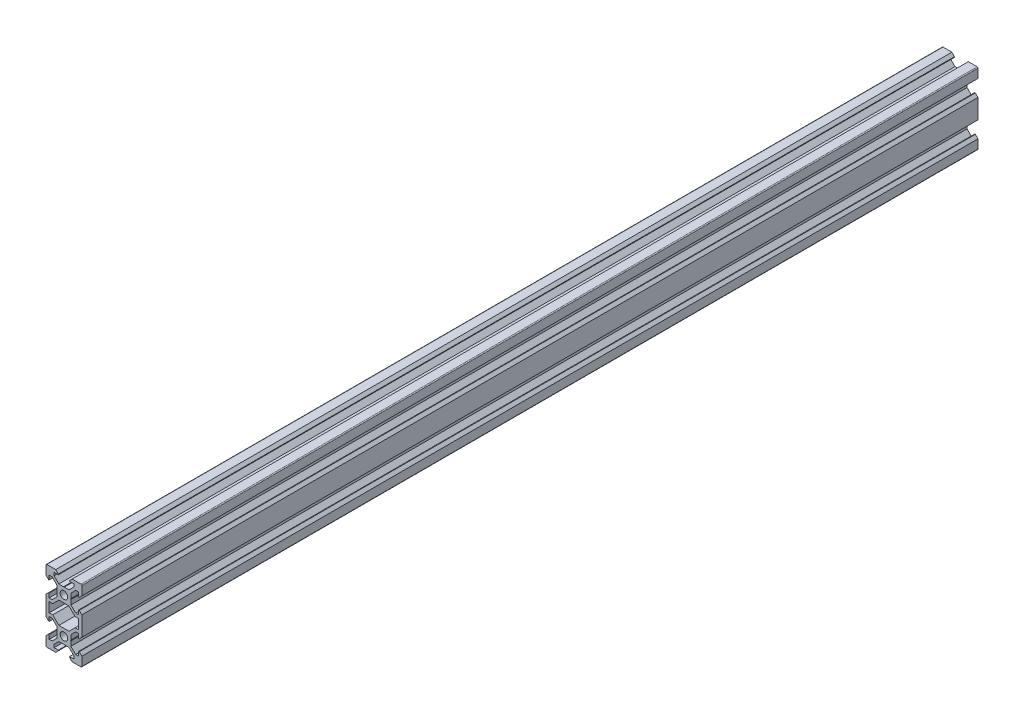
from build123d import *

# Parameters (mm, degrees)
SKETCH2_R           = 2.1
BOSS_EXTRUDE1_DEPTH = 500


with BuildPart() as part:
    # Sketch2 → Boss-Extrude1 (new body)
    with BuildSketch(Plane.XY):
        with BuildLine():
            Line((4.006804208, 10.145798499), (3.796804208, 10.355798499))
            Line((3.796804208, 10.355798499), (4.006804208, 10.565798499))
            Line((4.006804208, 10.565798499), (4.006804208, 13.195138327))
            Line((4.006804208, 13.195138327), (6.66746438, 15.855798499))
            Line((6.66746438, 15.855798499), (8.306804208, 15.855798499))
            Line((8.306804208, 15.855798499), (8.306804208, 13.480798499))
            Line((8.306804208, 13.480798499), (8.651804208, 13.480798499))
            Line((8.651804208, 13.480798499), (10.106804208, 14.935798499))
            Line((10.106804208, 14.935798499), (10.106804208, 19.855798499))
            ThreePointArc((10.106804208, 19.855798499), (9.960357598, 20.209351889), (9.606804208, 20.355798499))
            Line((9.606804208, 20.355798499), (4.686804208, 20.355798499))
            Line((4.686804208, 20.355798499), (3.231804208, 18.900798499))
            Line((3.231804208, 18.900798499), (3.231804208, 18.555798499))
            Line((3.231804208, 18.555798499), (5.606804208, 18.555798499))
            Line((5.606804208, 18.555798499), (5.606804208, 16.91645867))
            Line((5.606804208, 16.91645867), (2.946144036, 14.255798499))
            Line((2.946144036, 14.255798499), (0.316804208, 14.255798499))
            Line((0.316804208, 14.255798499), (0.106804208, 14.045798499))
            Line((0.106804208, 14.045798499), (-0.103195792, 14.255798499))
            Line((-0.103195792, 14.255798499), (-2.73253562, 14.255798499))
            Line((-2.73253562, 14.255798499), (-5.393195792, 16.91645867))
            Line((-5.393195792, 16.91645867), (-5.393195792, 18.555798499))
            Line((-5.393195792, 18.555798499), (-3.018195792, 18.555798499))
            Line((-3.018195792, 18.555798499), (-3.018195792, 18.900798499))
            Line((-3.018195792, 18.900798499), (-4.473195792, 20.355798499))
            Line((-4.473195792, 20.355798499), (-9.393195792, 20.355798499))
            ThreePointArc((-9.393195792, 20.355798499), (-9.746749183, 20.209351889), (-9.893195792, 19.855798499))
            Line((-9.893195792, 19.855798499), (-9.893195792, 14.935798499))
            Line((-9.893195792, 14.935798499), (-8.438195792, 13.480798499))
            Line((-8.438195792, 13.480798499), (-8.093195792, 13.480798499))
            Line((-8.093195792, 13.480798499), (-8.093195792, 15.855798499))
            Line((-8.093195792, 15.855798499), (-6.453855964, 15.855798499))
            Line((-6.453855964, 15.855798499), (-3.793195792, 13.195138327))
            Line((-3.793195792, 13.195138327), (-3.793195792, 10.565798499))
            Line((-3.793195792, 10.565798499), (-3.583195792, 10.355798499))
            Line((-3.583195792, 10.355798499), (-3.793195792, 10.145798499))
            Line((-3.793195792, 10.145798499), (-3.793195792, 7.51645867))
            Line((-3.793195792, 7.51645867), (-6.453855964, 4.855798499))
            Line((-6.453855964, 4.855798499), (-8.093195792, 4.855798499))
            Line((-8.093195792, 4.855798499), (-8.093195792, 7.230798499))
            Line((-8.093195792, 7.230798499), (-8.438195792, 7.230798499))
            Line((-8.438195792, 7.230798499), (-9.893195792, 5.775798499))
            Line((-9.893195792, 5.775798499), (-9.893195792, -5.064201501))
            Line((-9.893195792, -5.064201501), (-8.438195792, -6.519201501))
            Line((-8.438195792, -6.519201501), (-8.093195792, -6.519201501))
            Line((-8.093195792, -6.519201501), (-8.093195792, -4.144201501))
            Line((-8.093195792, -4.144201501), (-6.453855964, -4.144201501))
            Line((-6.453855964, -4.144201501), (-3.793195792, -6.804861673))
            Line((-3.793195792, -6.804861673), (-3.793195792, -9.434201501))
            Line((-3.793195792, -9.434201501), (-3.583195792, -9.644201501))
            Line((-3.583195792, -9.644201501), (-3.793195792, -9.854201501))
            Line((-3.793195792, -9.854201501), (-3.793195792, -12.48354133))
            Line((-3.793195792, -12.48354133), (-6.453855964, -15.144201501))
            Line((-6.453855964, -15.144201501), (-8.093195792, -15.144201501))
            Line((-8.093195792, -15.144201501), (-8.093195792, -12.769201501))
            Line((-8.093195792, -12.769201501), (-8.438195792, -12.769201501))
            Line((-8.438195792, -12.769201501), (-9.893195792, -14.224201501))
            Line((-9.893195792, -14.224201501), (-9.893195792, -19.144201501))
            ThreePointArc((-9.893195792, -19.144201501), (-9.746749183, -19.497754892), (-9.393195792, -19.644201501))
            Line((-9.393195792, -19.644201501), (-4.473195792, -19.644201501))
            Line((-4.473195792, -19.644201501), (-3.018195792, -18.189201501))
            Line((-3.018195792, -18.189201501), (-3.018195792, -17.844201501))
            Line((-3.018195792, -17.844201501), (-5.393195792, -17.844201501))
            Line((-5.393195792, -17.844201501), (-5.393195792, -16.204861673))
            Line((-5.393195792, -16.204861673), (-2.73253562, -13.544201501))
            Line((-2.73253562, -13.544201501), (-0.103195792, -13.544201501))
            Line((-0.103195792, -13.544201501), (0.106804208, -13.334201501))
            Line((0.106804208, -13.334201501), (0.316804208, -13.544201501))
            Line((0.316804208, -13.544201501), (2.946144036, -13.544201501))
            Line((2.946144036, -13.544201501), (5.606804208, -16.204861673))
            Line((5.606804208, -16.204861673), (5.606804208, -17.844201501))
            Line((5.606804208, -17.844201501), (3.231804208, -17.844201501))
            Line((3.231804208, -17.844201501), (3.231804208, -18.189201501))
            Line((3.231804208, -18.189201501), (4.686804208, -19.644201501))
            Line((4.686804208, -19.644201501), (9.606804208, -19.644201501))
            ThreePointArc((9.606804208, -19.644201501), (9.960357598, -19.497754892), (10.106804208, -19.144201501))
            Line((10.106804208, -19.144201501), (10.106804208, -14.224201501))
            Line((10.106804208, -14.224201501), (8.651804208, -12.769201501))
            Line((8.651804208, -12.769201501), (8.306804208, -12.769201501))
            Line((8.306804208, -12.769201501), (8.306804208, -15.144201501))
            Line((8.306804208, -15.144201501), (6.66746438, -15.144201501))
            Line((6.66746438, -15.144201501), (4.006804208, -12.48354133))
            Line((4.006804208, -12.48354133), (4.006804208, -9.854201501))
            Line((4.006804208, -9.854201501), (3.796804208, -9.644201501))
            Line((3.796804208, -9.644201501), (4.006804208, -9.434201501))
            Line((4.006804208, -9.434201501), (4.006804208, -6.804861673))
            Line((4.006804208, -6.804861673), (6.66746438, -4.144201501))
            Line((6.66746438, -4.144201501), (8.306804208, -4.144201501))
            Line((8.306804208, -4.144201501), (8.306804208, -6.519201501))
            Line((8.306804208, -6.519201501), (8.651804208, -6.519201501))
            Line((8.651804208, -6.519201501), (10.106804208, -5.064201501))
            Line((10.106804208, -5.064201501), (10.106804208, 5.775798499))
            Line((10.106804208, 5.775798499), (8.651804208, 7.230798499))
            Line((8.651804208, 7.230798499), (8.306804208, 7.230798499))
            Line((8.306804208, 7.230798499), (8.306804208, 4.855798499))
            Line((8.306804208, 4.855798499), (6.66746438, 4.855798499))
            Line((6.66746438, 4.855798499), (4.006804208, 7.51645867))
            Line((4.006804208, 7.51645867), (4.006804208, 10.145798499))
        make_face()
        with Locations((0.106804208, -9.644201501)):
            Circle(SKETCH2_R, mode=Mode.SUBTRACT)
        with Locations((0.106804208, 10.355798499)):
            Circle(SKETCH2_R, mode=Mode.SUBTRACT)
        Polygon((-6.13253562, -2.344201501), (-2.73253562, -5.744201501), (2.946144036, -5.744201501), (6.346144036, -2.344201501), (8.306804208, -2.344201501), (8.306804208, 3.055798499), (6.346144036, 3.055798499), (2.946144036, 6.455798499), (-2.73253562, 6.455798499), (-6.13253562, 3.055798499), (-8.093195792, 3.055798499), (-8.093195792, -2.344201501), align=None, mode=Mode.SUBTRACT)
    extrude(amount=BOSS_EXTRUDE1_DEPTH)


solid = part.part
